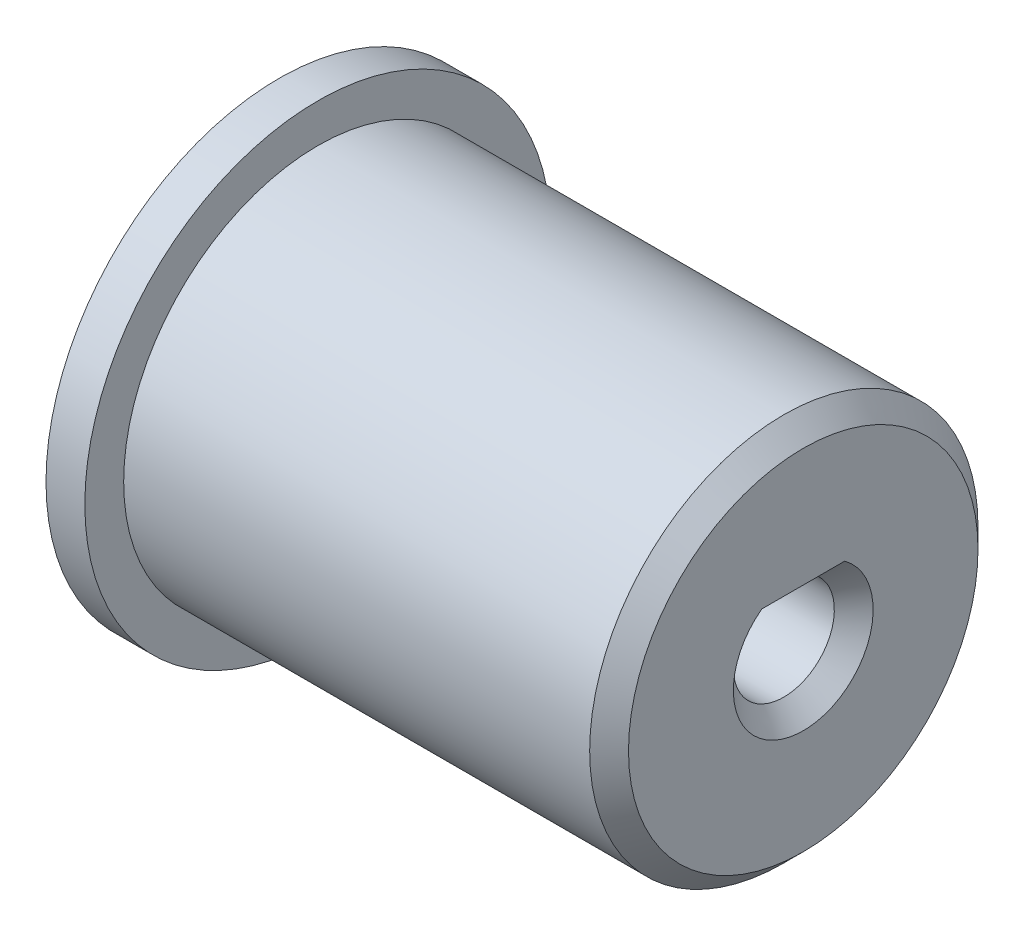
from build123d import *

# Parameters (mm, degrees)
SKIZZE2_R                            = 10
AUFSATZ_LINEAR_AUSTRAGEN1_DEPTH      = 25
SKIZZE3_R                            = 12
AUFSATZ_LINEAR_AUSTRAGEN2_DEPTH      = 2
SCHNITT_LINEAR_AUSTRAGEN1_DEPTH      = 15
FASE1_SIZE                           = 1
FASE2_SIZE                           = 1
F_3_1_3_1_DURCHMESSER_BOHRUNG1_D     = 3.1
F_3_1_3_1_DURCHMESSER_BOHRUNG1_DEPTH = 7
F_3_1_3_1_DURCHMESSER_BOHRUNG1_TIP   = 0.931333959
FASE3_SIZE                           = 1


with BuildPart() as part:
    # Skizze2 → Aufsatz-Linear austragen1 (new body)
    with BuildSketch(Plane(origin=(0, 0, 0), x_dir=(0, 0, -1), z_dir=(1, 0, 0))):
        Circle(SKIZZE2_R)
    extrude(amount=AUFSATZ_LINEAR_AUSTRAGEN1_DEPTH)

    # Skizze3 → Aufsatz-Linear austragen2 (add)
    with BuildSketch(Plane.ZY):
        Circle(SKIZZE3_R)
    extrude(amount=AUFSATZ_LINEAR_AUSTRAGEN2_DEPTH)

    # Skizze4 → Schnitt-Linear austragen1 (cut)
    with BuildSketch(Plane(origin=(25, 0, 0), x_dir=(0, 0, -1), z_dir=(1, 0, 0))):
        with BuildLine():
            Line((-1.774823935, 1.9), (1.774823935, 1.9))
            ThreePointArc((1.774823935, 1.9), (0, -2.6), (-1.774823935, 1.9))
        make_face()
    extrude(amount=-SCHNITT_LINEAR_AUSTRAGEN1_DEPTH, mode=Mode.SUBTRACT)

    # Fase1
    fase1_edges = [part.edges().sort_by_distance(p)[0] for p in [
        (25, -2.6, 0),
        (25, 1.9, 0),
    ]]
    chamfer(fase1_edges, length=FASE1_SIZE)

    # Fase2
    fase2_edges = [part.edges().sort_by_distance(p)[0] for p in [
        (25, 0, 10),
    ]]
    chamfer(fase2_edges, length=FASE2_SIZE)

    # Ø3.1 (3.1) Durchmesser Bohrung1
    with Locations(Plane.ZY.offset(2)):
        with Locations((4.25, 0), (-4.25, 0)):
            Hole(F_3_1_3_1_DURCHMESSER_BOHRUNG1_D / 2, depth=F_3_1_3_1_DURCHMESSER_BOHRUNG1_DEPTH)
            with Locations((0, 0, -(F_3_1_3_1_DURCHMESSER_BOHRUNG1_DEPTH + F_3_1_3_1_DURCHMESSER_BOHRUNG1_TIP / 2))):  # 118° drill point
                Cone(0, F_3_1_3_1_DURCHMESSER_BOHRUNG1_D / 2, F_3_1_3_1_DURCHMESSER_BOHRUNG1_TIP, mode=Mode.SUBTRACT)

    # Fase3
    fase3_edges = [part.edges().sort_by_distance(p)[0] for p in [
        (-2, 0, 5.8),
        (-2, 0, -2.7),
    ]]
    chamfer(fase3_edges, length=FASE3_SIZE)


solid = part.part
